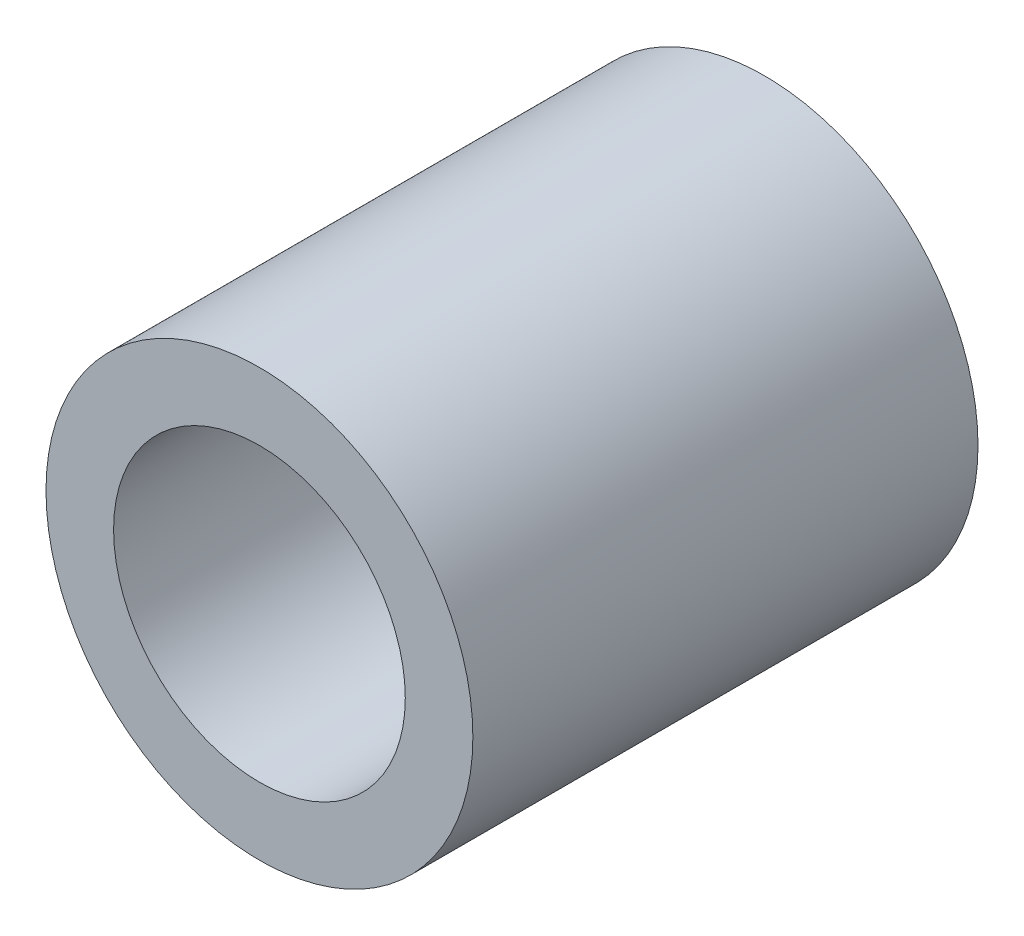
from build123d import *

# Parameters (mm, degrees)
SKETCH1_R           = 3
SKETCH1_R_2         = 2.05
BOSS_EXTRUDE1_DEPTH = 7.1


with BuildPart() as part:
    # Sketch1 → Boss-Extrude1 (new body)
    with BuildSketch(Plane.XY):
        Circle(SKETCH1_R)
        Circle(SKETCH1_R_2, mode=Mode.SUBTRACT)
    extrude(amount=BOSS_EXTRUDE1_DEPTH)


solid = part.part
